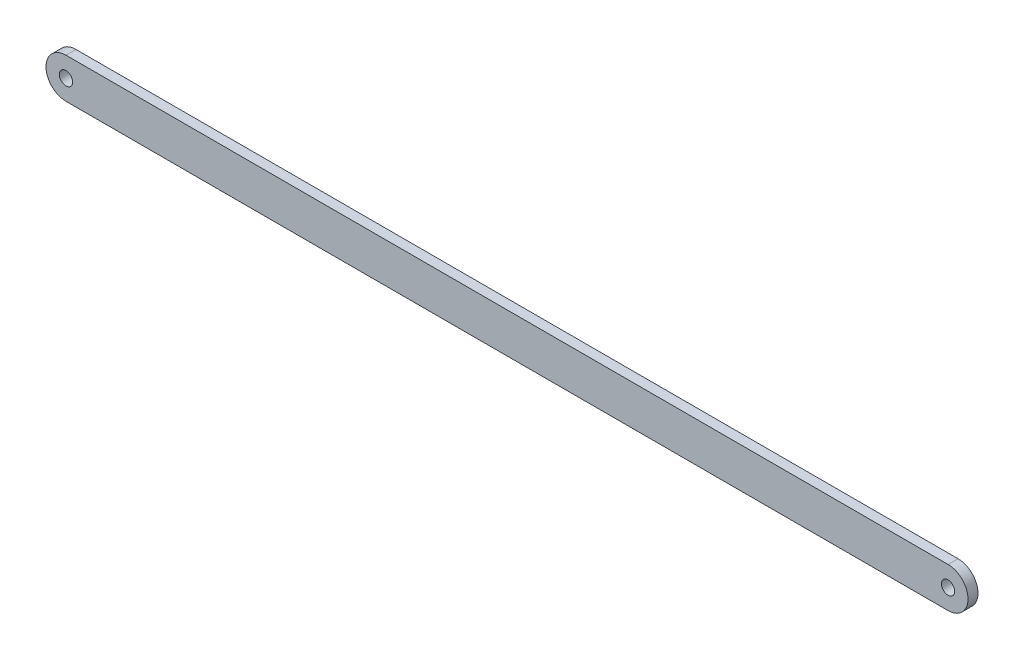
from build123d import *

# Parameters (mm, degrees)
SKETCH1_R           = 2
BOSS_EXTRUDE3_DEPTH = 3


with BuildPart() as part:
    # Sketch1 → Boss-Extrude3 (new body)
    with BuildSketch(Plane.XY):
        with BuildLine():
            Line((-35.312724167, 6), (229.687275833, 6))
            ThreePointArc((229.687275833, 6), (235.687275833, 0), (229.687275833, -6))
            Line((229.687275833, -6), (-35.312724167, -6))
            ThreePointArc((-35.312724167, -6), (-41.312724167, 0), (-35.312724167, 6))
        make_face()
        with Locations((-35.312724167, 0)):
            Circle(SKETCH1_R, mode=Mode.SUBTRACT)
        with Locations((229.687275833, 0)):
            Circle(SKETCH1_R, mode=Mode.SUBTRACT)
    extrude(amount=BOSS_EXTRUDE3_DEPTH)


solid = part.part
